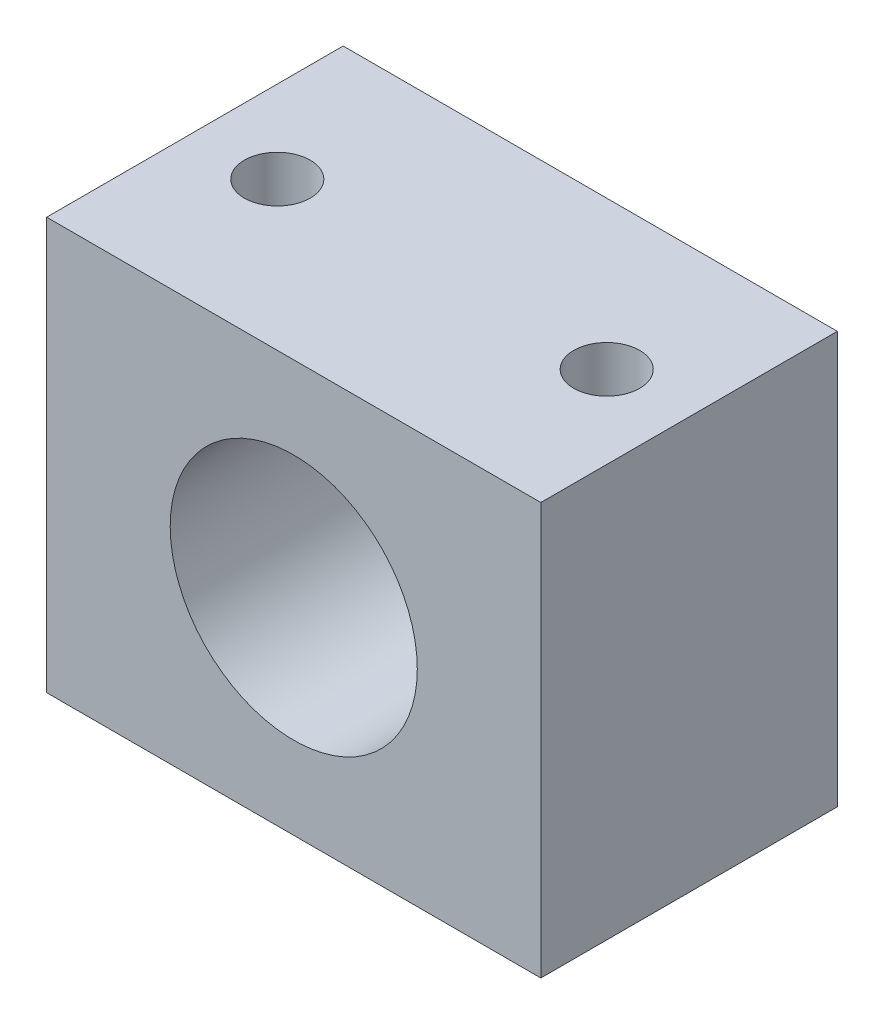
from build123d import *

# Parameters (mm, degrees)
SKETCH1_W           = 30
SKETCH1_H           = 25
SKETCH1_R           = 7.5
BOSS_EXTRUDE1_DEPTH = 18
SKETCH3_R           = 2
CUT_EXTRUDE1_DEPTH  = 35.263683398


with BuildPart() as part:
    # Sketch1 → Boss-Extrude1 (new body)
    with BuildSketch(Plane.XY):
        Rectangle(SKETCH1_W, SKETCH1_H)
        Circle(SKETCH1_R, mode=Mode.SUBTRACT)
    extrude(amount=BOSS_EXTRUDE1_DEPTH)

    # Sketch3 → Cut-Extrude1 (cut, through all)
    with BuildSketch(Plane(origin=(0, 12.5, 0), x_dir=(1, 0, 0), z_dir=(0, 1, 0))):
        with Locations(Location((-10, -9, 0), (0, 0, 270))):
            Circle(SKETCH3_R)
        with Locations(Location((10, -9, 0), (0, 0, 90))):
            Circle(SKETCH3_R)
    extrude(amount=-CUT_EXTRUDE1_DEPTH, mode=Mode.SUBTRACT)


solid = part.part
